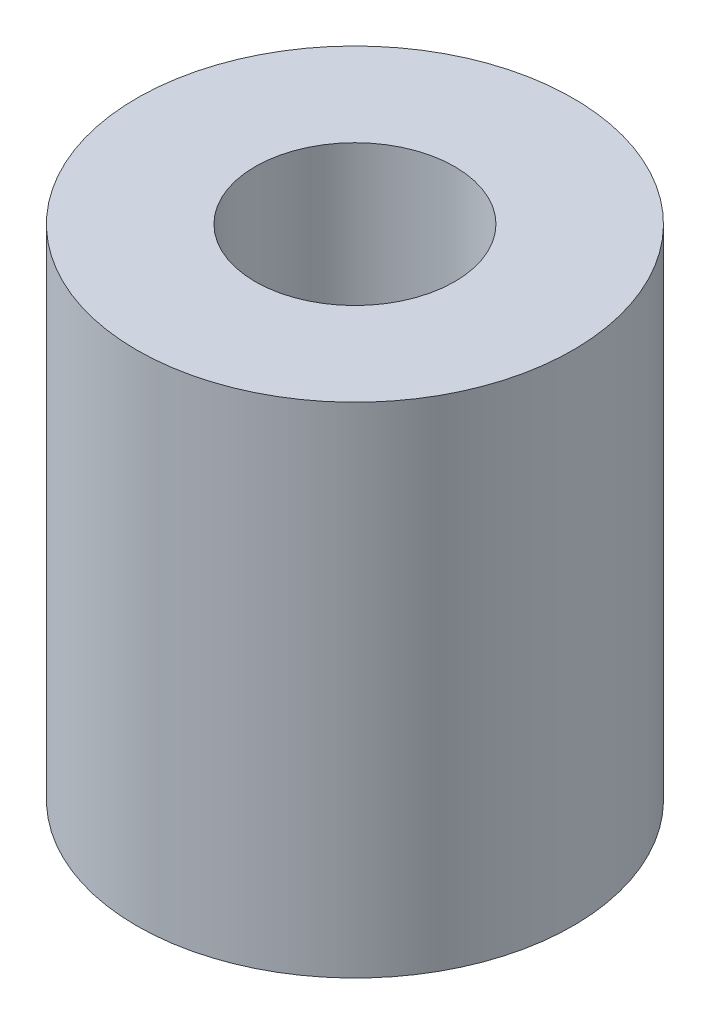
from build123d import *

# Parameters (mm, degrees)
SKETCH1_R             = 1.75
BOSS_EXTRUDE1_DEPTH   = 4
M2X0_4_TAPPED_HOLE1_D = 1.6


with BuildPart() as part:
    # Sketch1 → Boss-Extrude1 (new body)
    with BuildSketch(Plane(origin=(0, 0, 0), x_dir=(1, 0, 0), z_dir=(0, 1, 0))):
        with Locations(Location((0, 0, 0), (0, 0, 270))):
            Circle(SKETCH1_R)
    extrude(amount=BOSS_EXTRUDE1_DEPTH)

    # M2x0.4 Tapped Hole1 (through all)
    with Locations(Plane(origin=(0, 4, 0), x_dir=(1, 0, 0), z_dir=(0, 1, 0))):
        with Locations((0, 0)):
            Hole(M2X0_4_TAPPED_HOLE1_D / 2)


solid = part.part
